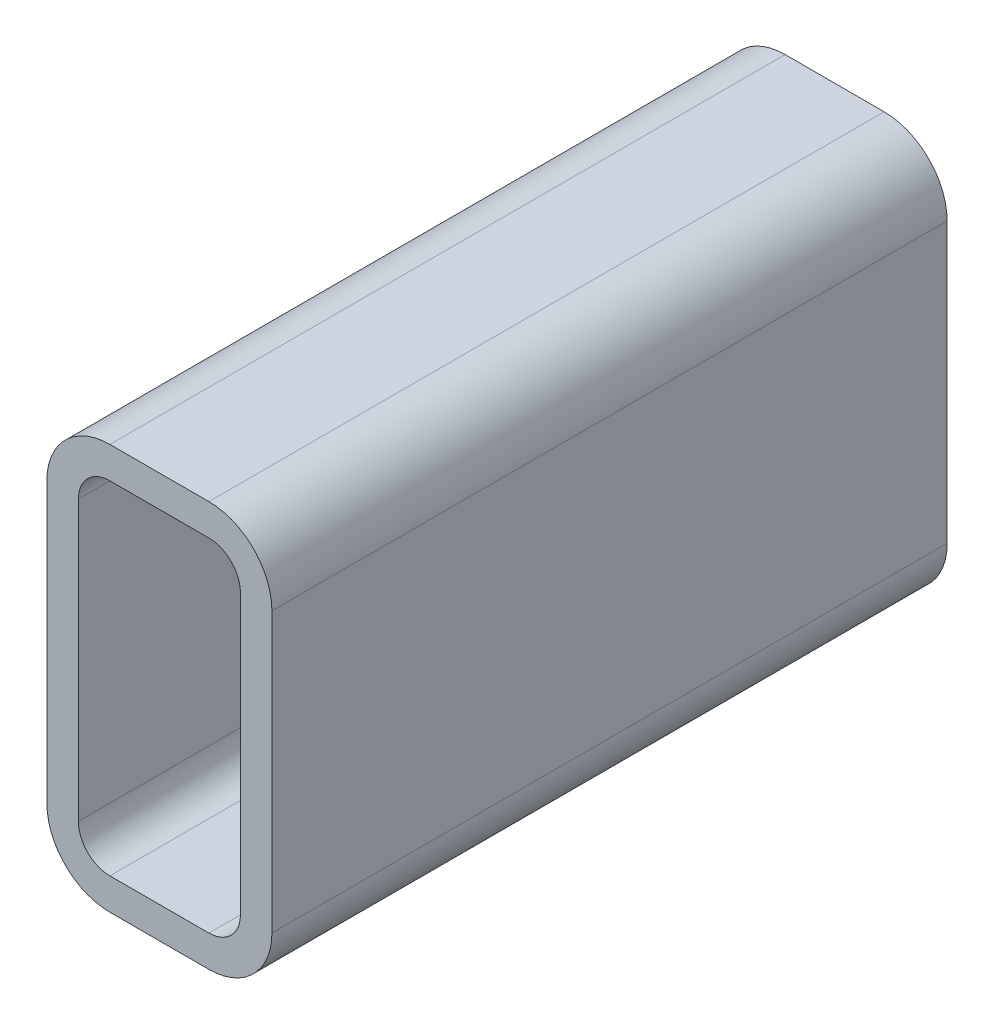
from build123d import *

# Parameters (mm, degrees)
SKETCH_1_W      = 100
SKETCH_1_H      = 180
SKETCH_1_W_2    = 72
SKETCH_1_H_2    = 152
EXTRUDE_1_DEPTH = 300
FILLET_1_R      = 14
FILLET_2_R      = 28


with BuildPart() as part:
    # 草图1 → 凸台-拉伸1 (new body)
    with BuildSketch(Plane.XY):
        Rectangle(SKETCH_1_W, SKETCH_1_H)
        Rectangle(SKETCH_1_W_2, SKETCH_1_H_2, mode=Mode.SUBTRACT)
    extrude(amount=EXTRUDE_1_DEPTH)

    # 圆角1
    fillet_1_edges = [part.edges().sort_by_distance(p)[0] for p in [
        (-36, -76, 150),
        (-36, 76, 150),
        (36, 76, 150),
        (36, -76, 150),
    ]]
    fillet(fillet_1_edges, radius=FILLET_1_R)

    # 圆角2
    fillet_2_edges = [part.edges().sort_by_distance(p)[0] for p in [
        (-50, -90, 150),
        (50, -90, 150),
        (-50, 90, 150),
        (50, 90, 150),
    ]]
    fillet(fillet_2_edges, radius=FILLET_2_R)


solid = part.part
